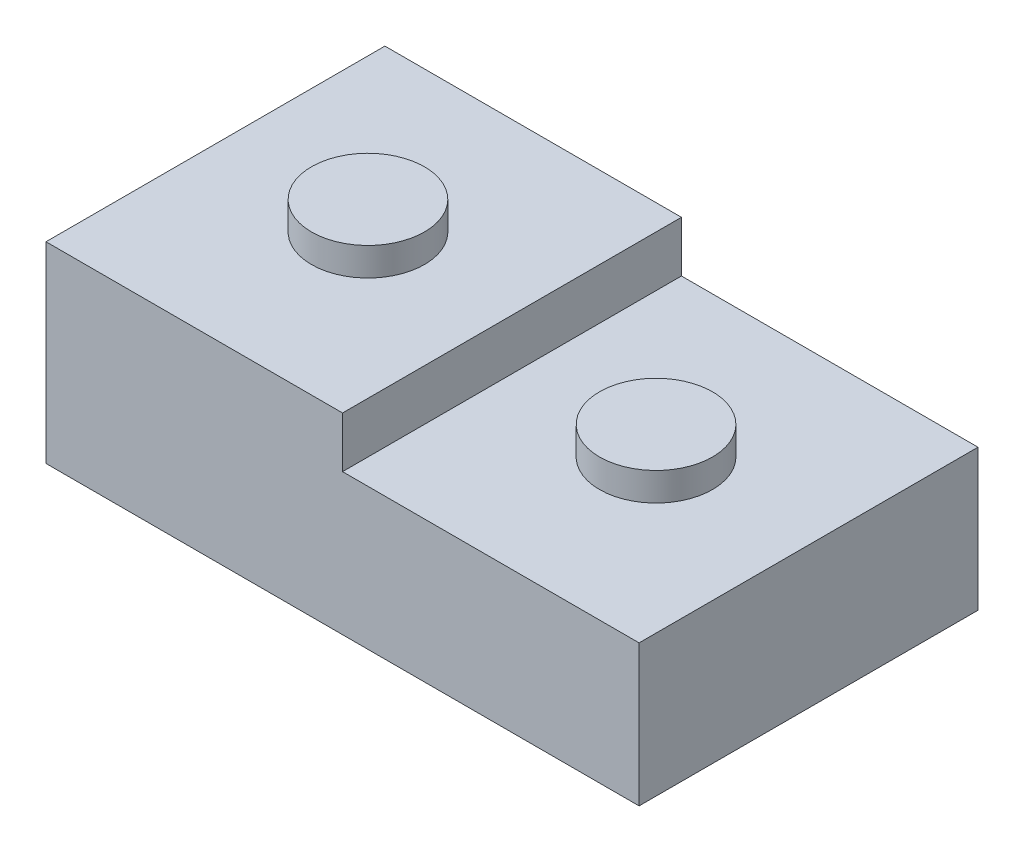
from build123d import *

# Parameters (mm, degrees)
SKETCH1_W           = 210
SKETCH1_H           = 120
BOSS_EXTRUDE1_DEPTH = 50
SKETCH2_W           = 105
SKETCH2_H           = 120
BOSS_EXTRUDE2_DEPTH = 18
SKETCH3_R           = 20
BOSS_EXTRUDE3_DEPTH = 10
SKETCH4_R           = 20
BOSS_EXTRUDE4_DEPTH = 10


with BuildPart() as part:
    # Sketch1 → Boss-Extrude1 (new body)
    with BuildSketch(Plane(origin=(0, 0, 0), x_dir=(1, 0, 0), z_dir=(0, 1, 0))):
        Rectangle(SKETCH1_W, SKETCH1_H)
    extrude(amount=BOSS_EXTRUDE1_DEPTH)

    # Sketch2 → Boss-Extrude2 (add)
    with BuildSketch(Plane(origin=(0, 50, 0), x_dir=(1, 0, 0), z_dir=(0, 1, 0))):
        with Locations((-52.5, 0)):
            Rectangle(SKETCH2_W, SKETCH2_H)
    extrude(amount=BOSS_EXTRUDE2_DEPTH)

    # Sketch3 → Boss-Extrude3 (add)
    with BuildSketch(Plane(origin=(0, 68, 0), x_dir=(1, 0, 0), z_dir=(0, 1, 0))):
        with Locations(Location((-51, 0, 0), (0, 0, 270))):
            Circle(SKETCH3_R)
    extrude(amount=BOSS_EXTRUDE3_DEPTH)

    # Sketch4 → Boss-Extrude4 (add)
    with BuildSketch(Plane(origin=(0, 50, 0), x_dir=(1, 0, 0), z_dir=(0, 1, 0))):
        with Locations(Location((51, 0, 0), (0, 0, 270))):
            Circle(SKETCH4_R)
    extrude(amount=BOSS_EXTRUDE4_DEPTH)


solid = part.part
